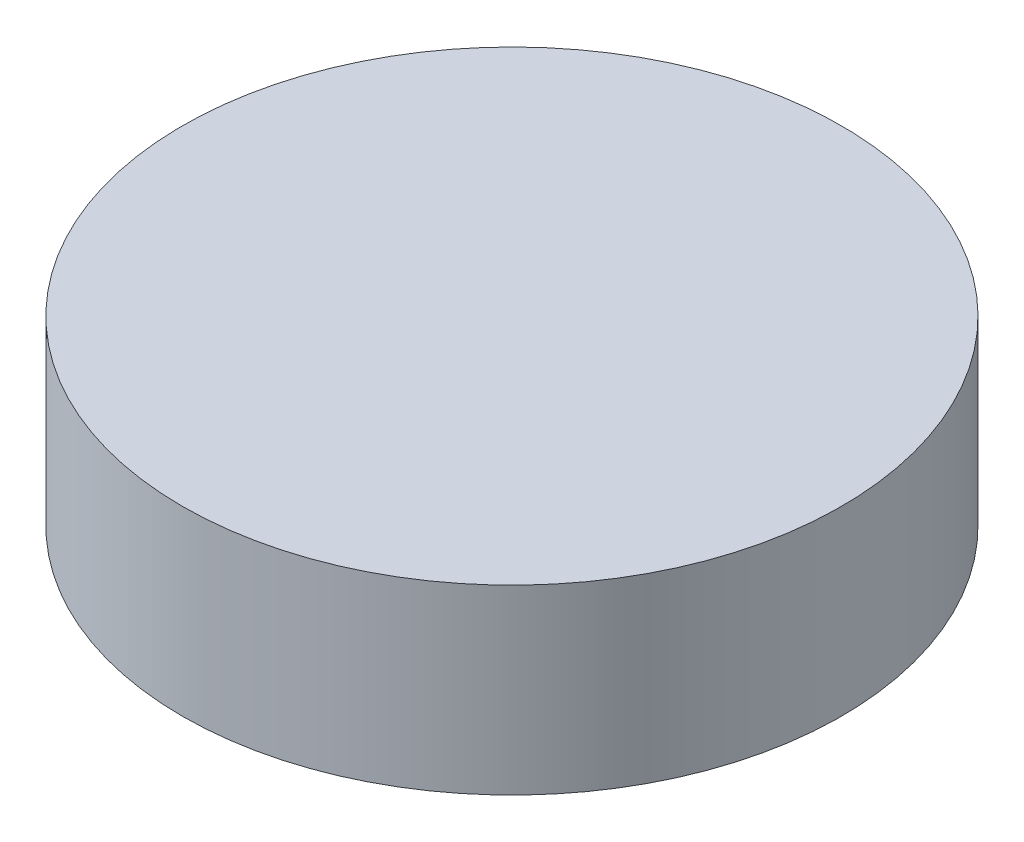
from build123d import *

# Parameters (mm, degrees)
SKETCH1_R           = 10.605
BOSS_EXTRUDE1_DEPTH = 5.85


with BuildPart() as part:
    # Sketch1 → Boss-Extrude1 (new body)
    with BuildSketch(Plane(origin=(0, 0, 0), x_dir=(1, 0, 0), z_dir=(0, 1, 0))):
        with Locations(Location((0, 0, 0), (0, 0, 270))):
            Circle(SKETCH1_R)
    extrude(amount=BOSS_EXTRUDE1_DEPTH)


solid = part.part
